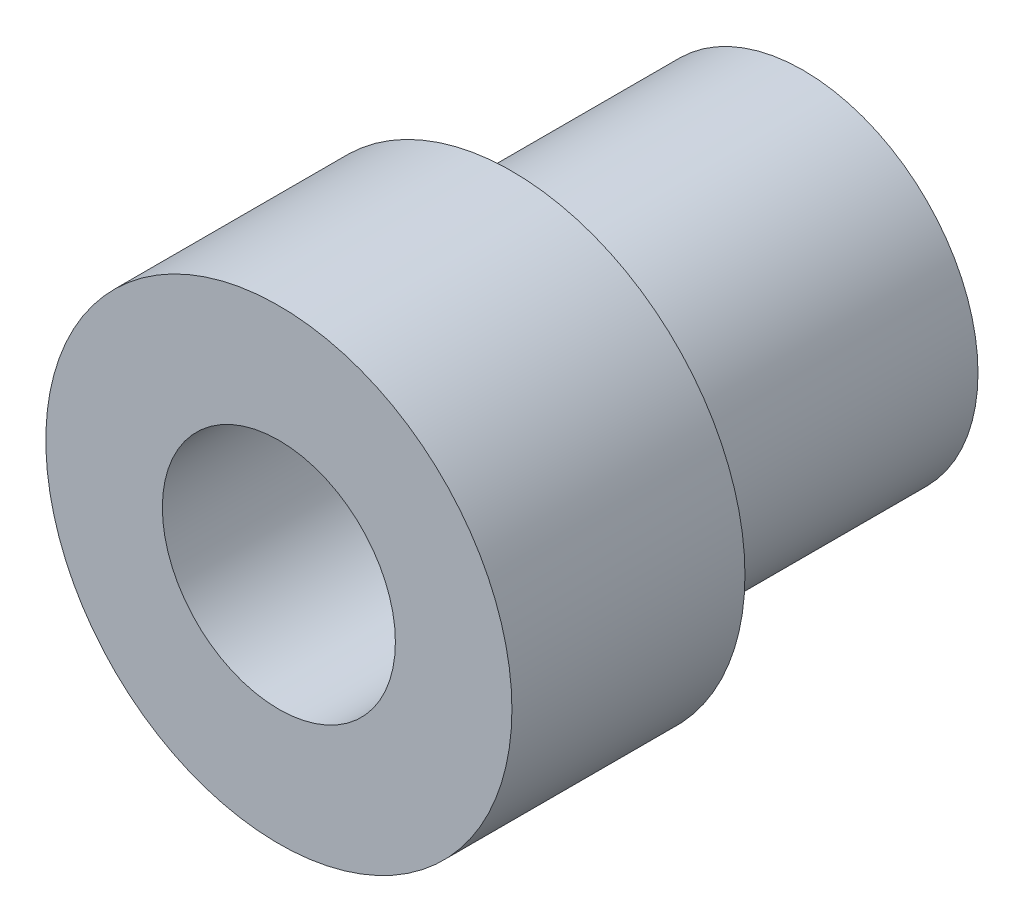
from build123d import *

# Parameters (mm, degrees)
SKETCH1_R           = 6.35
BOSS_EXTRUDE1_DEPTH = 6.35
SKETCH2_R           = 4.7625
BOSS_EXTRUDE2_DEPTH = 7.9375
SKETCH3_R           = 3.175
CUT_EXTRUDE1_DEPTH  = 14.2875


with BuildPart() as part:
    # Sketch1 → Boss-Extrude1 (new body)
    with BuildSketch(Plane.XY):
        Circle(SKETCH1_R)
    extrude(amount=BOSS_EXTRUDE1_DEPTH)

    # Sketch2 → Boss-Extrude2 (add)
    with BuildSketch(Plane(origin=(0, 0, 0), x_dir=(-1, 0, 0), z_dir=(0, 0, -1))):
        with Locations(Location((0, 0, 0), (0, 0, 180))):
            Circle(SKETCH2_R)
    extrude(amount=BOSS_EXTRUDE2_DEPTH)

    # Sketch3 → Cut-Extrude1 (cut)
    with BuildSketch(Plane(origin=(0, 0, -7.9375), x_dir=(-1, 0, 0), z_dir=(0, 0, -1))):
        Circle(SKETCH3_R)
    extrude(amount=-CUT_EXTRUDE1_DEPTH, mode=Mode.SUBTRACT)


solid = part.part
